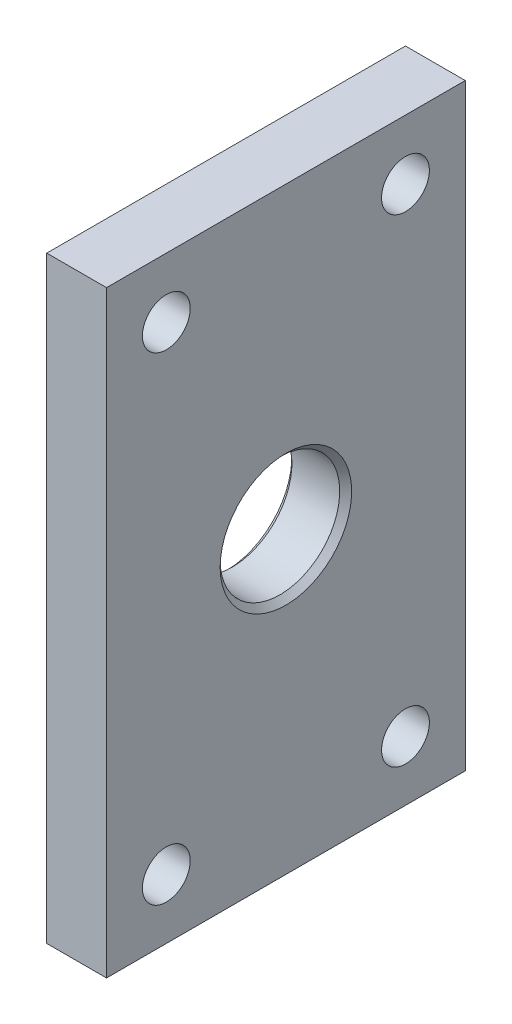
from build123d import *

# Parameters (mm, degrees)
SKETCH1_W           = 100
SKETCH1_H           = 60
BOSS_EXTRUDE1_DEPTH = 10
CUT_EXTRUDE2_START  = 10
SKETCH2_R           = 4
CUT_EXTRUDE2_DEPTH  = 128.046999107
CUT_EXTRUDE4_START  = 10
SKETCH3_R           = 4
CUT_EXTRUDE4_DEPTH  = 128.046999107
CUT_EXTRUDE6_START  = 10
SKETCH4_R           = 10
CUT_EXTRUDE6_DEPTH  = 128.046999107
CHAMFER1_SIZE       = 1


with BuildPart() as part:
    # Sketch1 → Boss-Extrude1 (new body)
    with BuildSketch(Plane.YZ):
        with Locations((50, 30)):
            Rectangle(SKETCH1_W, SKETCH1_H)
    extrude(amount=BOSS_EXTRUDE1_DEPTH)

    # Sketch2 → Cut-Extrude2 (cut, through all)
    with BuildSketch(Plane.YZ.offset(CUT_EXTRUDE2_START)):
        with Locations(Location((10, 10, 0), (0, 0, 270))):
            Circle(SKETCH2_R)
    extrude(amount=-CUT_EXTRUDE2_DEPTH, mode=Mode.SUBTRACT)

    # Sketch3 → Cut-Extrude4 (cut, through all)
    with BuildSketch(Plane.YZ.offset(CUT_EXTRUDE4_START)):
        with Locations(Location((90, 10, 0), (0, 0, 270))):
            Circle(SKETCH3_R)
        with Locations(Location((10, 50, 0), (0, 0, 270))):
            Circle(SKETCH3_R)
        with Locations(Location((90, 50, 0), (0, 0, 270))):
            Circle(SKETCH3_R)
    extrude(amount=-CUT_EXTRUDE4_DEPTH, mode=Mode.SUBTRACT)

    # Sketch4 → Cut-Extrude6 (cut, through all)
    with BuildSketch(Plane.YZ.offset(CUT_EXTRUDE6_START)):
        with Locations(Location((50, 30, 0), (0, 0, 270))):
            Circle(SKETCH4_R)
    extrude(amount=-CUT_EXTRUDE6_DEPTH, mode=Mode.SUBTRACT)

    # Chamfer1
    chamfer1_edges = [part.edges().sort_by_distance(p)[0] for p in [
        (0, 50, 40),
        (10, 50, 40),
    ]]
    chamfer(chamfer1_edges, length=CHAMFER1_SIZE)


solid = part.part
